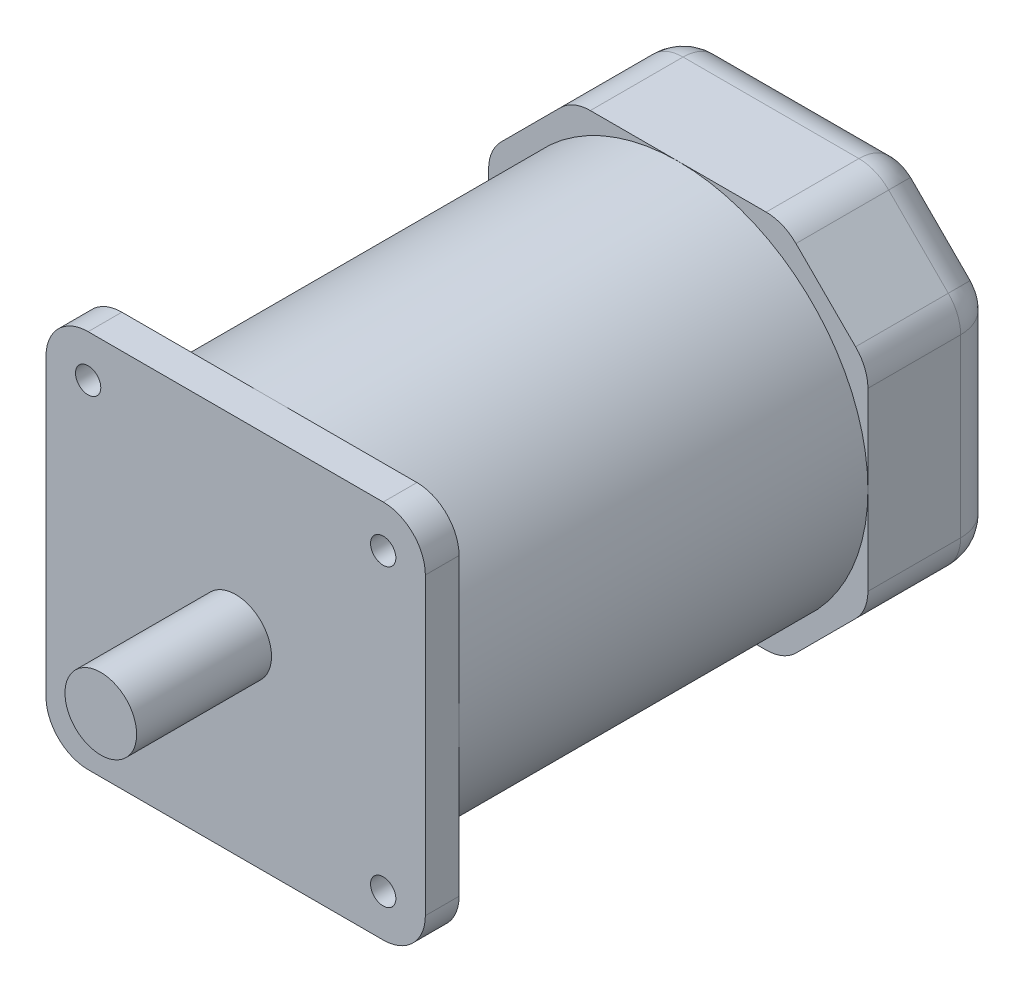
from build123d import *

# Parameters (mm, degrees)
SKETCH1_W                   = 90
SKETCH1_H                   = 90
BOSS_EXTRUDE1_DEPTH         = 8
FILLET1_R                   = 10
SKETCH2_R                   = 45
BOSS_EXTRUDE2_DEPTH         = 137
SKETCH3_R                   = 8.5
BOSS_EXTRUDE3_DEPTH         = 32
F_6_0_MM_DOWEL_HOLES1_D     = 6
F_6_0_MM_DOWEL_HOLES1_DEPTH = 30
F_6_0_MM_DOWEL_HOLES1_TIP   = 1.802581857
SKETCH8_W                   = 90
SKETCH8_H                   = 90
BOSS_EXTRUDE4_DEPTH         = 32
CHAMFER2_SIZE               = 20
FILLET2_R                   = 10


with BuildPart() as part:
    # Sketch1 → Boss-Extrude1 (new body)
    with BuildSketch(Plane.XY):
        Rectangle(SKETCH1_W, SKETCH1_H)
    extrude(amount=BOSS_EXTRUDE1_DEPTH)

    # Fillet1
    fillet1_edges = [part.edges().sort_by_distance(p)[0] for p in [
        (-45, 45, 4),
        (45, 45, 4),
        (45, -45, 4),
        (-45, -45, 4),
    ]]
    fillet(fillet1_edges, radius=FILLET1_R)

    # Sketch2 → Boss-Extrude2 (add)
    with BuildSketch(Plane.XY.offset(8)):
        Circle(SKETCH2_R)
    extrude(amount=-BOSS_EXTRUDE2_DEPTH)

    # Sketch3 → Boss-Extrude3 (add)
    with BuildSketch(Plane.XY.offset(8)):
        Circle(SKETCH3_R)
    extrude(amount=BOSS_EXTRUDE3_DEPTH)

    # Ø6.0 mm Dowel Holes1
    with Locations(Plane.XY.offset(8)):
        with Locations((-35, 35), (35, 35), (35, -35), (-35, -35)):
            Hole(F_6_0_MM_DOWEL_HOLES1_D / 2, depth=F_6_0_MM_DOWEL_HOLES1_DEPTH)
            with Locations((0, 0, -(F_6_0_MM_DOWEL_HOLES1_DEPTH + F_6_0_MM_DOWEL_HOLES1_TIP / 2))):  # 118° drill point
                Cone(0, F_6_0_MM_DOWEL_HOLES1_D / 2, F_6_0_MM_DOWEL_HOLES1_TIP, mode=Mode.SUBTRACT)

    # Sketch8 → Boss-Extrude4 (add)
    with BuildSketch(Plane(origin=(0, 0, -129), x_dir=(-1, 0, 0), z_dir=(0, 0, -1))):
        Rectangle(SKETCH8_W, SKETCH8_H)
    extrude(amount=-BOSS_EXTRUDE4_DEPTH)

    # Chamfer2
    chamfer2_edges = [part.edges().sort_by_distance(p)[0] for p in [
        (45, -45, -113),
        (45, 45, -113),
        (-45, 45, -113),
        (-45, -45, -113),
    ]]
    chamfer(chamfer2_edges, length=CHAMFER2_SIZE)

    # Fillet2
    fillet2_edges = [part.edges().sort_by_distance(p)[0] for p in [
        (45, 0, -129),
        (45, 25, -113),
        (45, -25, -113),
        (-45, 0, -129),
        (0, 45, -129),
        (0, -45, -129),
        (35, 35, -129),
        (-35, 35, -129),
        (-35, -35, -129),
        (35, -35, -129),
        (-25, -45, -113),
        (25, -45, -113),
        (-45, 25, -113),
        (-45, -25, -113),
        (25, 45, -113),
        (-25, 45, -113),
    ]]
    fillet(fillet2_edges, radius=FILLET2_R)


solid = part.part
